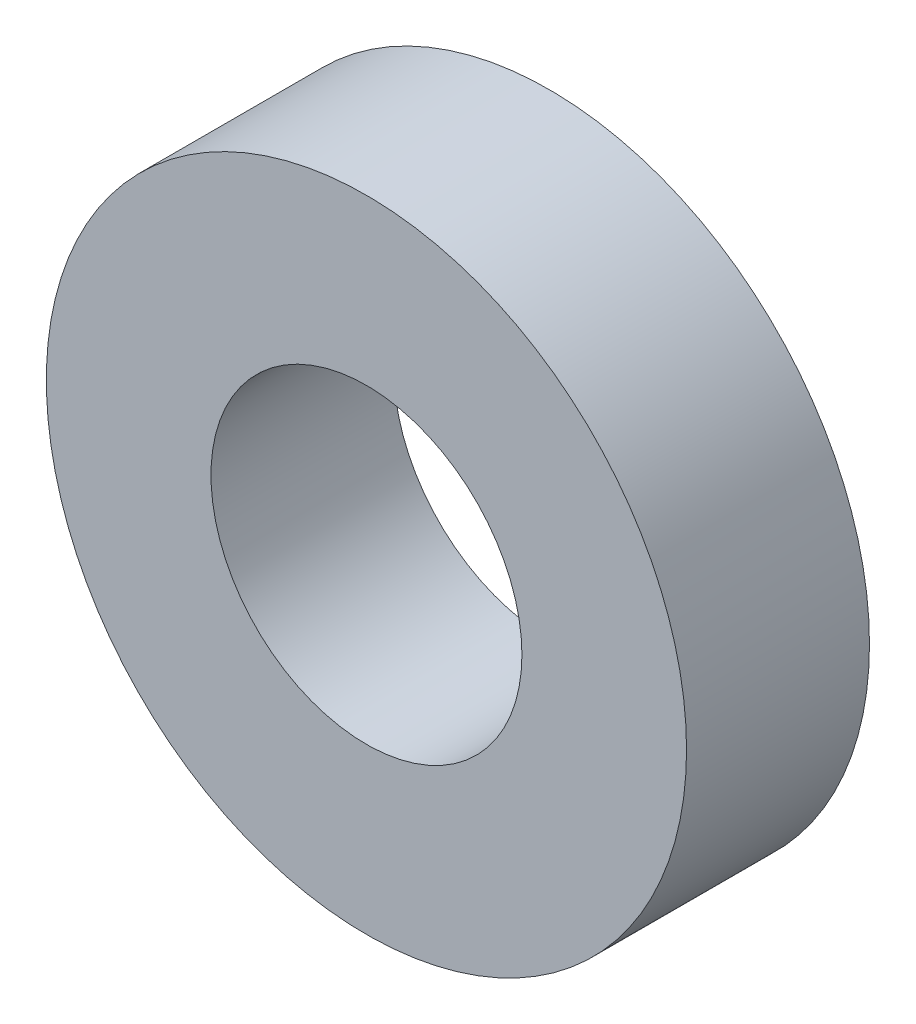
from build123d import *

# Parameters (mm, degrees)
M3_CLEARANCE_PROFILE_R   = 3.5
M3_CLEARANCE_PROFILE_R_2 = 1.7
M3_CLEARANCE_DEPTH       = 2


with BuildPart() as part:
    # M3 clearance profile → M3 clearance (new body)
    with BuildSketch(Plane.XY):
        Circle(M3_CLEARANCE_PROFILE_R)
        Circle(M3_CLEARANCE_PROFILE_R_2, mode=Mode.SUBTRACT)
    extrude(amount=M3_CLEARANCE_DEPTH)


solid = part.part
